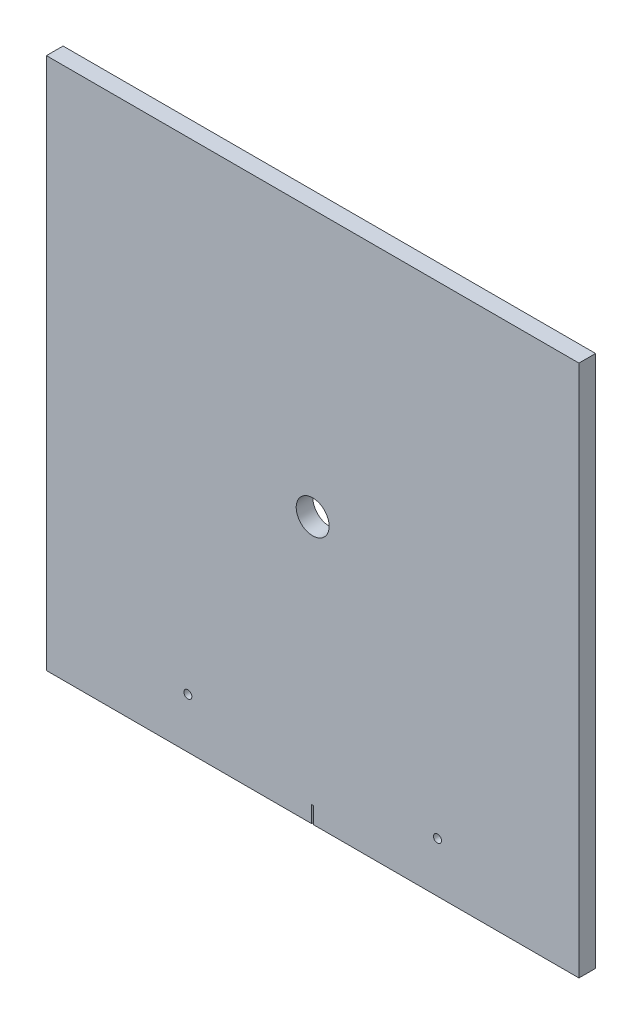
from build123d import *

# Parameters (mm, degrees)
SKETCH1_W      = 203.2
SKETCH1_H      = 203.2
EXTRUDE1_DEPTH = 6.35
SKETCH2_R      = 6.2865
EXTRUDE2_DEPTH = 144.824345992
SKETCH3_R      = 1.524
EXTRUDE3_DEPTH = 144.824345992
SKETCH4_W      = 0.79375
SKETCH4_H      = 6.35
EXTRUDE4_DEPTH = 6.35


with BuildPart() as part:
    # Sketch1 → Extrude1 (new body)
    with BuildSketch(Plane.XY):
        Rectangle(SKETCH1_W, SKETCH1_H)
    extrude(amount=EXTRUDE1_DEPTH)

    # Sketch2 → Extrude2 (cut, through all)
    with BuildSketch(Plane.XY.offset(6.35)):
        Circle(SKETCH2_R)
    extrude(amount=-EXTRUDE2_DEPTH, mode=Mode.SUBTRACT)

    # Sketch3 → Extrude3 (cut, through all)
    with BuildSketch(Plane.XY.offset(6.35)):
        with Locations((-47.625, -82.48891971)):
            Circle(SKETCH3_R)
        with Locations((47.625, -82.48891971)):
            Circle(SKETCH3_R)
    extrude(amount=-EXTRUDE3_DEPTH, mode=Mode.SUBTRACT)

    # Sketch4 → Extrude4 (cut)
    with BuildSketch(Plane.XY.offset(6.35)):
        with Locations((0, -98.425)):
            Rectangle(SKETCH4_W, SKETCH4_H)
    extrude(amount=-EXTRUDE4_DEPTH, mode=Mode.SUBTRACT)


solid = part.part
